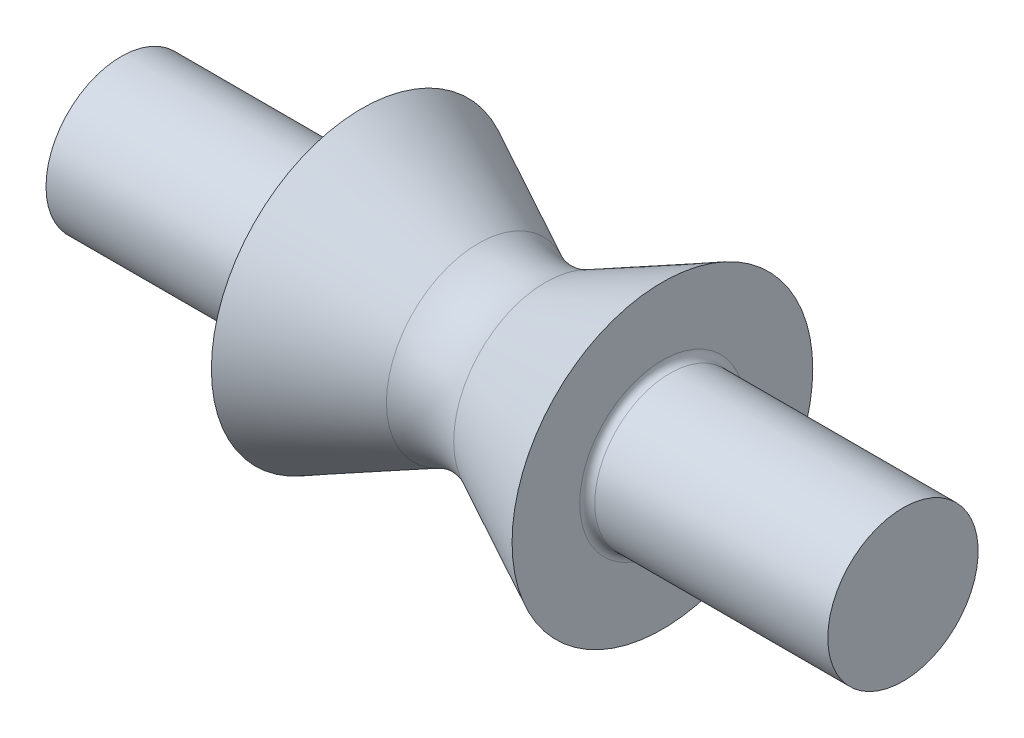
from build123d import *

# Parameters (mm, degrees)
FILLET1_R = 1
FILLET2_R = 10


with BuildPart() as part:
    # Sketch1 → Revolve1 (revolve)
    with BuildSketch(Plane.XY, mode=Mode.PRIVATE) as revolve1_sk:
        Polygon((0, 0), (0, 10), (32, 10), (32, 20), (52, 10), (72, 20), (72, 10), (104, 10), (104, 0), align=None)
    revolve(revolve1_sk.sketch.rotate(Axis((0, 0, 0), (1, 0, 0)), 90), axis=Axis((0, 0, 0), (1, 0, 0)))

    # Fillet1
    fillet1_edges = [part.edges().sort_by_distance(p)[0] for p in [
        (32, 0, -10),
        (72, 0, -10),
    ]]
    fillet(fillet1_edges, radius=FILLET1_R)

    # Fillet2
    fillet2_edges = [part.edges().sort_by_distance(p)[0] for p in [
        (52, 0, -10),
    ]]
    fillet(fillet2_edges, radius=FILLET2_R)


solid = part.part
